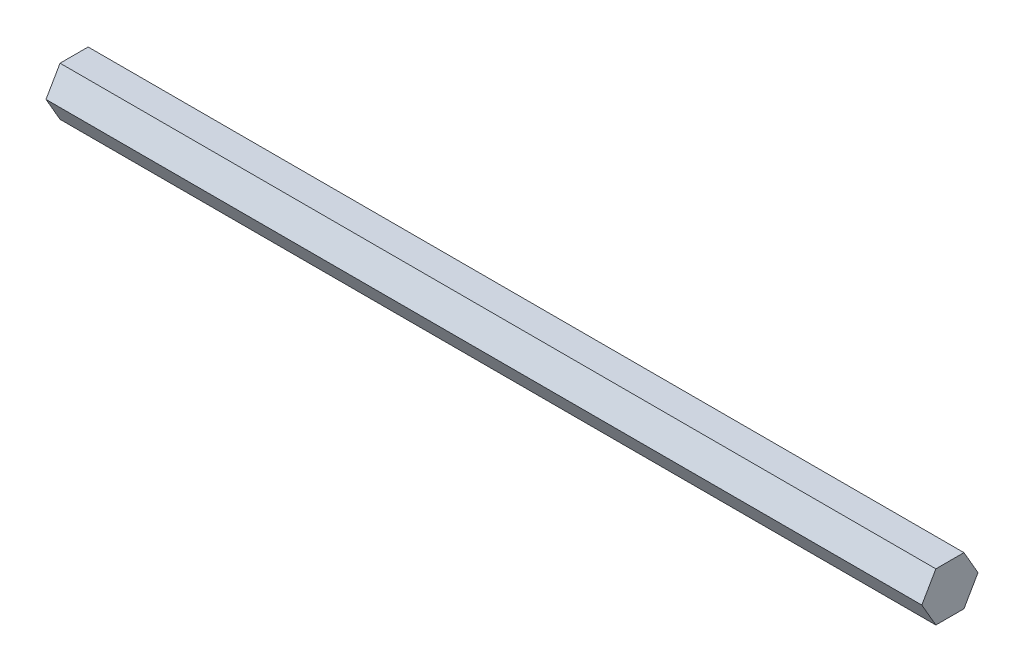
from build123d import *

# Parameters (mm, degrees)
BOSS_EXTRUDE1_DEPTH = 228.6


with BuildPart() as part:
    # Sketch1 → Boss-Extrude1 (new body)
    with BuildSketch(Plane(origin=(0, 0, 0), x_dir=(0, -1, 0), z_dir=(-1, 0, 0))):
        Polygon((0, 7.332348419), (-6.35, 3.666174209), (-6.35, -3.666174209), (0, -7.332348419), (6.35, -3.666174209), (6.35, 3.666174209), align=None)
    extrude(amount=-BOSS_EXTRUDE1_DEPTH)


solid = part.part
